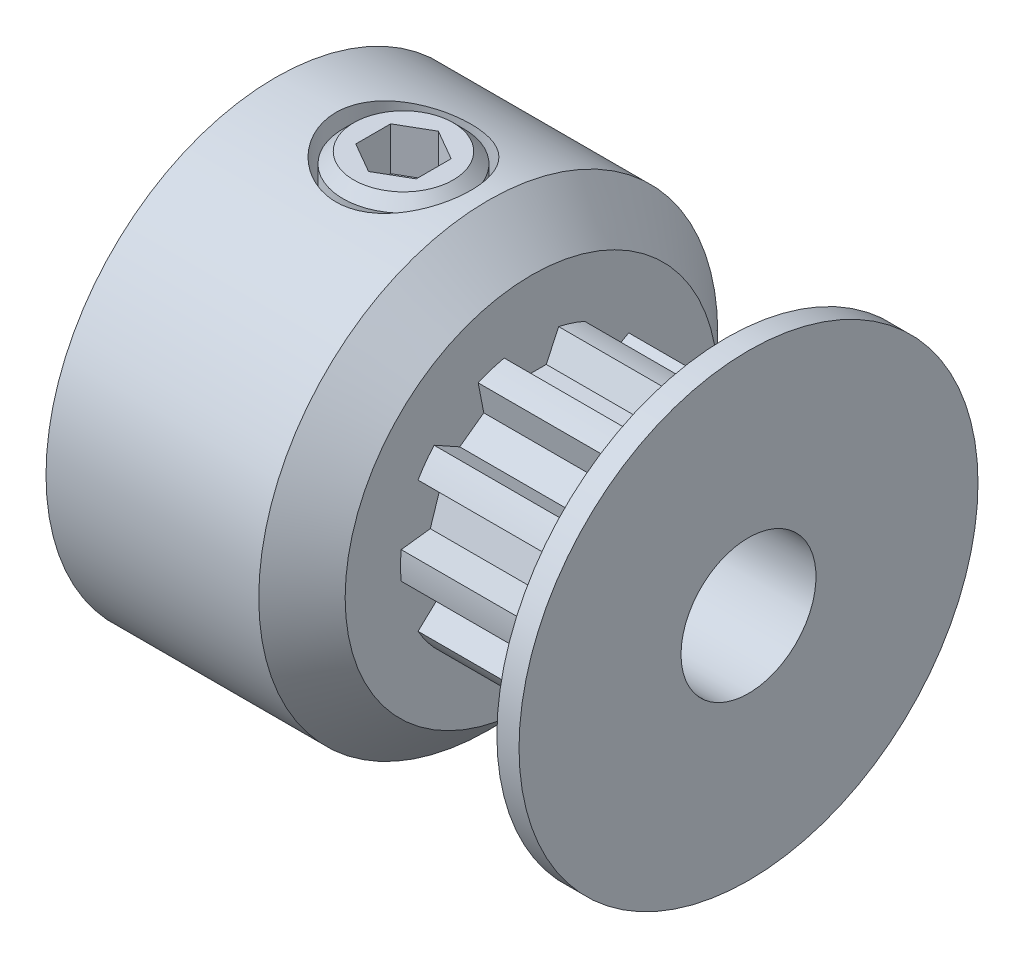
from build123d import *

# Parameters (mm, degrees)
SKETCH4_R          = 3.2385
SKETCH4_R_2        = 3.07975
CUT_EXTRUDE2_DEPTH = 4.064
CUT_EXTRUDE1_DEPTH = 4.064
CIRPATTERN1_COUNT  = 10
SKETCH6_R          = 1.5875
CUT_EXTRUDE3_DEPTH = 10.4450268
CUT_EXTRUDE4_DEPTH = 1.016


with BuildPart() as part:
    # Sketch1 → Revolve1 (revolve)
    with BuildSketch(Plane.XY, mode=Mode.PRIVATE) as revolve1_sk:
        with BuildLine():
            Line((-5.5626, 1.5875), (5.5626, 1.5875))
            Line((5.5626, 1.5875), (5.5626, 5.3975))
            Line((5.5626, 5.3975), (5.0419, 5.3975))
            ThreePointArc((5.0419, 5.3975), (4.654699632, 4.645356921), (4.5212, 3.81))
            Line((4.5212, 3.81), (4.5212, 3.2385))
            Line((4.5212, 3.2385), (0.4572, 3.2385))
            Line((0.4572, 3.2385), (0.4572, 4.3815))
            Line((0.4572, 4.3815), (-0.5588, 5.3975))
            Line((-0.5588, 5.3975), (-5.5626, 5.3975))
            Line((-5.5626, 5.3975), (-5.5626, 1.5875))
        make_face()
    revolve(revolve1_sk.sketch.rotate(Axis((-5.5626, 0, 0), (1, 0, 0)), 90), axis=Axis((-5.5626, 0, 0), (1, 0, 0)))

    # Sketch4 → Cut-Extrude2 (cut)
    with BuildSketch(Plane(origin=(0.4572, 0, 0), x_dir=(0, 0, -1), z_dir=(1, 0, 0))):
        Circle(SKETCH4_R)
        Circle(SKETCH4_R_2, mode=Mode.SUBTRACT)
    extrude(amount=CUT_EXTRUDE2_DEPTH, mode=Mode.SUBTRACT)

    # Sketch3 → Cut-Extrude1 (cut)
    with BuildSketch(Plane(origin=(0.4572, 0, 0), x_dir=(0, 0, -1), z_dir=(1, 0, 0))):
        with BuildLine():
            Line((-0.640454656, 3.012420604), (-0.349102168, 2.387613176))
            Line((-0.349102168, 2.387613176), (0.349102168, 2.387613176))
            Line((0.349102168, 2.387613176), (0.640454656, 3.012420604))
            ThreePointArc((0.640454656, 3.012420604), (0, 3.07975), (-0.640454656, 3.012420604))
        make_face()
    cut_extrude1 = extrude(amount=CUT_EXTRUDE1_DEPTH, mode=Mode.SUBTRACT)

    # CirPattern1: Cut-Extrude1 ×10 about axis
    cirpattern1_axis = Axis((0, 0, 0), (1, 0, 0))
    for i in range(1, CIRPATTERN1_COUNT):
        add(cut_extrude1.rotate(cirpattern1_axis, i * 360 / CIRPATTERN1_COUNT), mode=Mode.SUBTRACT)

    # Sketch6 → Cut-Extrude3 (cut, through all)
    with BuildSketch(Plane(origin=(0, 0, 0), x_dir=(1, 0, 0), z_dir=(0, 1, 0))):
        with Locations(Location((-2.5527, 0, 0), (0, 0, 90))):
            Circle(SKETCH6_R)
    extrude(amount=CUT_EXTRUDE3_DEPTH, mode=Mode.SUBTRACT)


with BuildPart() as body_2:
    # Sketch7 → Revolve2 (revolve)
    with BuildSketch(Plane.XY, mode=Mode.PRIVATE) as revolve2_sk:
        Polygon((-3.7211, 5.3975), (-2.5527, 5.3975), (-2.5527, 1.9685), (-3.7211, 1.9685), (-3.9751, 2.2225), (-3.9751, 5.1435), align=None)
    revolve(revolve2_sk.sketch.rotate(Axis((-2.5527, 1.9685, 0), (0, 1, 0)), 180), axis=Axis((-2.5527, 1.9685, 0), (0, 1, 0)))

    # Sketch8 → Cut-Extrude4 (cut)
    with BuildSketch(Plane(origin=(0, 5.3975, 0), x_dir=(1, 0, 0), z_dir=(0, 1, 0))):
        Polygon((-2.5527, 0.821223023), (-3.2639, 0.410611511), (-3.2639, -0.410611511), (-2.5527, -0.821223023), (-1.8415, -0.410611511), (-1.8415, 0.410611511), align=None)
    extrude(amount=-CUT_EXTRUDE4_DEPTH, mode=Mode.SUBTRACT)


solid = Compound([part.part, body_2.part])
